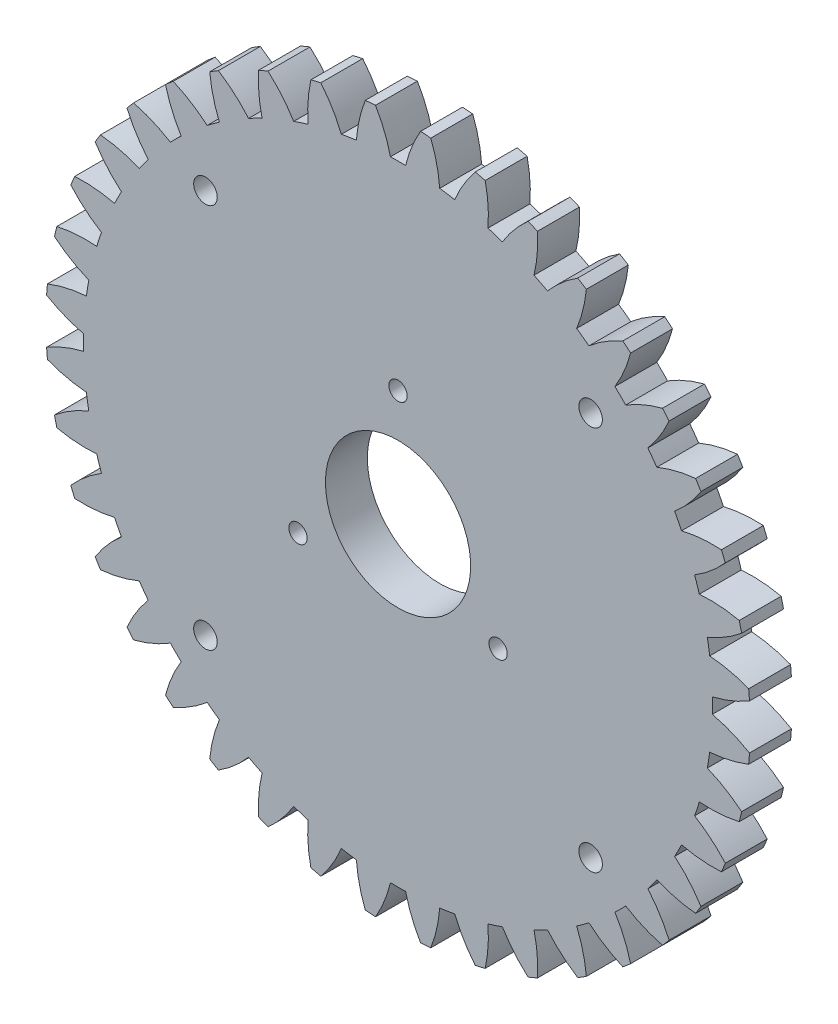
from build123d import *

# Parameters (mm, degrees)
SKETCH1_R           = 1.7859375
SKETCH1_R_2         = 19.05
BOSS_EXTRUDE1_DEPTH = 6.35
BOSS_EXTRUDE2_START = -6.35
SKETCH2_R           = 19.05
BOSS_EXTRUDE2_DEPTH = 6.35
SKETCH3_R           = 11
SKETCH3_R_2         = 1.3890625
CUT_EXTRUDE1_DEPTH  = 76.546869742


with BuildPart() as part:
    # Sketch1 → Boss-Extrude1 (new body)
    with BuildSketch(Plane.XY):
        with BuildLine():
            ThreePointArc((-53.230663286, 3.41351521), (-50.505194995, 2.070176319), (-47.609884913, 1.148267265))
            ThreePointArc((-47.609884913, 1.148267265), (-47.62373, 0), (-47.609884913, -1.148267265))
            ThreePointArc((-47.609884913, -1.148267265), (-50.505194995, -2.070176319), (-53.230663286, -3.41351521))
            ThreePointArc((-53.230663286, -3.41351521), (-53.175570581, -4.185008166), (-53.109296916, -4.955621162))
            ThreePointArc((-53.109296916, -4.955621162), (-50.207239162, -5.856064147), (-47.203356801, -6.313696687))
            ThreePointArc((-47.203356801, -6.313696687), (-47.037402857, -7.449992726), (-46.84409965, -8.581957067))
            ThreePointArc((-46.84409965, -8.581957067), (-49.559545311, -9.945442174), (-52.041314064, -11.698599508))
            ThreePointArc((-52.041314064, -11.698599508), (-51.866211554, -12.451975708), (-51.680203396, -13.202733694))
            ThreePointArc((-51.680203396, -13.202733694), (-48.673014471, -13.638108879), (-45.634525385, -13.620196473))
            ThreePointArc((-45.634525385, -13.620196473), (-45.292858747, -14.716541906), (-44.924857187, -15.804330603))
            ThreePointArc((-44.924857187, -15.804330603), (-47.393575143, -17.575818236), (-49.570534975, -19.695625461))
            ThreePointArc((-49.570534975, -19.695625461), (-49.279734264, -20.412334282), (-48.978571751, -21.124751105))
            ThreePointArc((-48.978571751, -21.124751105), (-45.940298628, -21.084338109), (-42.942020503, -20.591321819))
            ThreePointArc((-42.942020503, -20.591321819), (-42.433054136, -21.620720982), (-41.899415644, -22.637549069))
            ThreePointArc((-41.899415644, -22.637549069), (-44.060617865, -24.773419322), (-45.879164799, -27.207679749))
            ThreePointArc((-45.879164799, -27.207679749), (-45.479826367, -27.870073442), (-45.070925119, -28.526607034))
            ThreePointArc((-45.070925119, -28.526607034), (-42.076380166, -28.011400959), (-39.192140559, -27.055420484))
            ThreePointArc((-39.192140559, -27.055420484), (-38.528406906, -27.992526153), (-37.842271431, -28.913355947))
            ThreePointArc((-37.842271431, -28.913355947), (-39.642741945, -31.361016606), (-41.058097322, -34.049790665))
            ThreePointArc((-41.058097322, -34.049790665), (-40.560054205, -34.641558898), (-40.053482729, -35.226043224))
            ThreePointArc((-40.053482729, -35.226043224), (-37.17640158, -34.248730153), (-34.477220043, -32.853324904))
            ThreePointArc((-34.477220043, -32.853324904), (-33.675062428, -33.675062428), (-32.853324904, -34.477220043))
            ThreePointArc((-32.853324904, -34.477220043), (-34.248730153, -37.17640158), (-35.226043224, -40.053482729))
            ThreePointArc((-35.226043224, -40.053482729), (-34.641558898, -40.560054205), (-34.049790665, -41.058097322))
            ThreePointArc((-34.049790665, -41.058097322), (-31.361016606, -39.642741945), (-28.913355947, -37.842271431))
            ThreePointArc((-28.913355947, -37.842271431), (-27.992526153, -38.528406906), (-27.055420484, -39.192140559))
            ThreePointArc((-27.055420484, -39.192140559), (-28.011400959, -42.076380166), (-28.526607034, -45.070925119))
            ThreePointArc((-28.526607034, -45.070925119), (-27.870073442, -45.479826367), (-27.207679749, -45.879164799))
            ThreePointArc((-27.207679749, -45.879164799), (-24.773419322, -44.060617865), (-22.637549069, -41.899415644))
            ThreePointArc((-22.637549069, -41.899415644), (-21.620720982, -42.433054136), (-20.591321819, -42.942020503))
            ThreePointArc((-20.591321819, -42.942020503), (-21.084338109, -45.940298628), (-21.124751105, -48.978571751))
            ThreePointArc((-21.124751105, -48.978571751), (-20.412334282, -49.279734264), (-19.695625461, -49.570534975))
            ThreePointArc((-19.695625461, -49.570534975), (-17.575818236, -47.393575143), (-15.804330603, -44.924857187))
            ThreePointArc((-15.804330603, -44.924857187), (-14.716541906, -45.292858747), (-13.620196473, -45.634525385))
            ThreePointArc((-13.620196473, -45.634525385), (-13.638108879, -48.673014471), (-13.202733694, -51.680203396))
            ThreePointArc((-13.202733694, -51.680203396), (-12.451975708, -51.866211554), (-11.698599508, -52.041314064))
            ThreePointArc((-11.698599508, -52.041314064), (-9.945442174, -49.559545311), (-8.581957067, -46.84409965))
            ThreePointArc((-8.581957067, -46.84409965), (-7.449992726, -47.037402857), (-6.313696687, -47.203356801))
            ThreePointArc((-6.313696687, -47.203356801), (-5.856064147, -50.207239162), (-4.955621162, -53.109296916))
            ThreePointArc((-4.955621162, -53.109296916), (-4.185008166, -53.175570581), (-3.41351521, -53.230663286))
            ThreePointArc((-3.41351521, -53.230663286), (-2.070176319, -50.505194995), (-1.148267265, -47.609884913))
            ThreePointArc((-1.148267265, -47.609884913), (0, -47.62373), (1.148267265, -47.609884913))
            ThreePointArc((1.148267265, -47.609884913), (2.070176319, -50.505194995), (3.41351521, -53.230663286))
            ThreePointArc((3.41351521, -53.230663286), (4.185008166, -53.175570581), (4.955621162, -53.109296916))
            ThreePointArc((4.955621162, -53.109296916), (5.856064147, -50.207239162), (6.313696687, -47.203356801))
            ThreePointArc((6.313696687, -47.203356801), (7.449992726, -47.037402857), (8.581957067, -46.84409965))
            ThreePointArc((8.581957067, -46.84409965), (9.945442174, -49.559545311), (11.698599508, -52.041314064))
            ThreePointArc((11.698599508, -52.041314064), (12.451975708, -51.866211554), (13.202733694, -51.680203396))
            ThreePointArc((13.202733694, -51.680203396), (13.638108879, -48.673014471), (13.620196473, -45.634525385))
            ThreePointArc((13.620196473, -45.634525385), (14.716541906, -45.292858747), (15.804330603, -44.924857187))
            ThreePointArc((15.804330603, -44.924857187), (17.575818236, -47.393575143), (19.695625461, -49.570534975))
            ThreePointArc((19.695625461, -49.570534975), (20.412334282, -49.279734264), (21.124751105, -48.978571751))
            ThreePointArc((21.124751105, -48.978571751), (21.084338109, -45.940298628), (20.591321819, -42.942020503))
            ThreePointArc((20.591321819, -42.942020503), (21.620720982, -42.433054136), (22.637549069, -41.899415644))
            ThreePointArc((22.637549069, -41.899415644), (24.773419322, -44.060617865), (27.207679749, -45.879164799))
            ThreePointArc((27.207679749, -45.879164799), (27.870073442, -45.479826367), (28.526607034, -45.070925119))
            ThreePointArc((28.526607034, -45.070925119), (28.011400959, -42.076380166), (27.055420484, -39.192140559))
            ThreePointArc((27.055420484, -39.192140559), (27.992526153, -38.528406906), (28.913355947, -37.842271431))
            ThreePointArc((28.913355947, -37.842271431), (31.361016606, -39.642741945), (34.049790665, -41.058097322))
            ThreePointArc((34.049790665, -41.058097322), (34.641558898, -40.560054205), (35.226043224, -40.053482729))
            ThreePointArc((35.226043224, -40.053482729), (34.248730153, -37.17640158), (32.853324904, -34.477220043))
            ThreePointArc((32.853324904, -34.477220043), (33.675062428, -33.675062428), (34.477220043, -32.853324904))
            ThreePointArc((34.477220043, -32.853324904), (37.17640158, -34.248730153), (40.053482729, -35.226043224))
            ThreePointArc((40.053482729, -35.226043224), (40.560054205, -34.641558898), (41.058097322, -34.049790665))
            ThreePointArc((41.058097322, -34.049790665), (39.642741945, -31.361016606), (37.842271431, -28.913355947))
            ThreePointArc((37.842271431, -28.913355947), (38.528406906, -27.992526153), (39.192140559, -27.055420484))
            ThreePointArc((39.192140559, -27.055420484), (42.076380166, -28.011400959), (45.070925119, -28.526607034))
            ThreePointArc((45.070925119, -28.526607034), (45.479826367, -27.870073442), (45.879164799, -27.207679749))
            ThreePointArc((45.879164799, -27.207679749), (44.060617865, -24.773419322), (41.899415644, -22.637549069))
            ThreePointArc((41.899415644, -22.637549069), (42.433054136, -21.620720982), (42.942020503, -20.591321819))
            ThreePointArc((42.942020503, -20.591321819), (45.940298628, -21.084338109), (48.978571751, -21.124751105))
            ThreePointArc((48.978571751, -21.124751105), (49.279734264, -20.412334282), (49.570534975, -19.695625461))
            ThreePointArc((49.570534975, -19.695625461), (47.393575143, -17.575818236), (44.924857187, -15.804330603))
            ThreePointArc((44.924857187, -15.804330603), (45.292858747, -14.716541906), (45.634525385, -13.620196473))
            ThreePointArc((45.634525385, -13.620196473), (48.673014471, -13.638108879), (51.680203396, -13.202733694))
            ThreePointArc((51.680203396, -13.202733694), (51.866211554, -12.451975708), (52.041314064, -11.698599508))
            ThreePointArc((52.041314064, -11.698599508), (49.559545311, -9.945442174), (46.84409965, -8.581957067))
            ThreePointArc((46.84409965, -8.581957067), (47.037402857, -7.449992726), (47.203356801, -6.313696687))
            ThreePointArc((47.203356801, -6.313696687), (50.207239162, -5.856064147), (53.109296916, -4.955621162))
            ThreePointArc((53.109296916, -4.955621162), (53.175570581, -4.185008166), (53.230663286, -3.41351521))
            ThreePointArc((53.230663286, -3.41351521), (50.505194995, -2.070176319), (47.609884913, -1.148267265))
            ThreePointArc((47.609884913, -1.148267265), (47.62373, 0), (47.609884913, 1.148267265))
            ThreePointArc((47.609884913, 1.148267265), (50.505194995, 2.070176319), (53.230663286, 3.41351521))
            ThreePointArc((53.230663286, 3.41351521), (53.175570581, 4.185008166), (53.109296916, 4.955621162))
            ThreePointArc((53.109296916, 4.955621162), (50.207239162, 5.856064147), (47.203356801, 6.313696687))
            ThreePointArc((47.203356801, 6.313696687), (47.037402857, 7.449992726), (46.84409965, 8.581957067))
            ThreePointArc((46.84409965, 8.581957067), (49.559545311, 9.945442174), (52.041314064, 11.698599508))
            ThreePointArc((52.041314064, 11.698599508), (51.866211554, 12.451975708), (51.680203396, 13.202733694))
            ThreePointArc((51.680203396, 13.202733694), (48.673014471, 13.638108879), (45.634525385, 13.620196473))
            ThreePointArc((45.634525385, 13.620196473), (45.292858747, 14.716541906), (44.924857187, 15.804330603))
            ThreePointArc((44.924857187, 15.804330603), (47.393575143, 17.575818236), (49.570534975, 19.695625461))
            ThreePointArc((49.570534975, 19.695625461), (49.279734264, 20.412334282), (48.978571751, 21.124751105))
            ThreePointArc((48.978571751, 21.124751105), (45.940298628, 21.084338109), (42.942020503, 20.591321819))
            ThreePointArc((42.942020503, 20.591321819), (42.433054136, 21.620720982), (41.899415644, 22.637549069))
            ThreePointArc((41.899415644, 22.637549069), (44.060617865, 24.773419322), (45.879164799, 27.207679749))
            ThreePointArc((45.879164799, 27.207679749), (45.479826367, 27.870073442), (45.070925119, 28.526607034))
            ThreePointArc((45.070925119, 28.526607034), (42.076380166, 28.011400959), (39.192140559, 27.055420484))
            ThreePointArc((39.192140559, 27.055420484), (38.528406906, 27.992526153), (37.842271431, 28.913355947))
            ThreePointArc((37.842271431, 28.913355947), (39.642741945, 31.361016606), (41.058097322, 34.049790665))
            ThreePointArc((41.058097322, 34.049790665), (40.560054205, 34.641558898), (40.053482729, 35.226043224))
            ThreePointArc((40.053482729, 35.226043224), (37.17640158, 34.248730153), (34.477220043, 32.853324904))
            ThreePointArc((34.477220043, 32.853324904), (33.675062428, 33.675062428), (32.853324904, 34.477220043))
            ThreePointArc((32.853324904, 34.477220043), (34.248730153, 37.17640158), (35.226043224, 40.053482729))
            ThreePointArc((35.226043224, 40.053482729), (34.641558898, 40.560054205), (34.049790665, 41.058097322))
            ThreePointArc((34.049790665, 41.058097322), (31.361016606, 39.642741945), (28.913355947, 37.842271431))
            ThreePointArc((28.913355947, 37.842271431), (27.992526153, 38.528406906), (27.055420484, 39.192140559))
            ThreePointArc((27.055420484, 39.192140559), (28.011400959, 42.076380166), (28.526607034, 45.070925119))
            ThreePointArc((28.526607034, 45.070925119), (27.870073442, 45.479826367), (27.207679749, 45.879164799))
            ThreePointArc((27.207679749, 45.879164799), (24.773419322, 44.060617865), (22.637549069, 41.899415644))
            ThreePointArc((22.637549069, 41.899415644), (21.620720982, 42.433054136), (20.591321819, 42.942020503))
            ThreePointArc((20.591321819, 42.942020503), (21.084338109, 45.940298628), (21.124751105, 48.978571751))
            ThreePointArc((21.124751105, 48.978571751), (20.412334282, 49.279734264), (19.695625461, 49.570534975))
            ThreePointArc((19.695625461, 49.570534975), (17.575818236, 47.393575143), (15.804330603, 44.924857187))
            ThreePointArc((15.804330603, 44.924857187), (14.716541906, 45.292858747), (13.620196473, 45.634525385))
            ThreePointArc((13.620196473, 45.634525385), (13.638108879, 48.673014471), (13.202733694, 51.680203396))
            ThreePointArc((13.202733694, 51.680203396), (12.451975708, 51.866211554), (11.698599508, 52.041314064))
            ThreePointArc((11.698599508, 52.041314064), (9.945442174, 49.559545311), (8.581957067, 46.84409965))
            ThreePointArc((8.581957067, 46.84409965), (7.449992726, 47.037402857), (6.313696687, 47.203356801))
            ThreePointArc((6.313696687, 47.203356801), (5.856064147, 50.207239162), (4.955621162, 53.109296916))
            ThreePointArc((4.955621162, 53.109296916), (4.185008166, 53.175570581), (3.41351521, 53.230663286))
            ThreePointArc((3.41351521, 53.230663286), (2.070176319, 50.505194995), (1.148267265, 47.609884913))
            ThreePointArc((1.148267265, 47.609884913), (0, 47.62373), (-1.148267265, 47.609884913))
            ThreePointArc((-1.148267265, 47.609884913), (-2.070176319, 50.505194995), (-3.41351521, 53.230663286))
            ThreePointArc((-3.41351521, 53.230663286), (-4.185008166, 53.175570581), (-4.955621162, 53.109296916))
            ThreePointArc((-4.955621162, 53.109296916), (-5.856064147, 50.207239162), (-6.313696687, 47.203356801))
            ThreePointArc((-6.313696687, 47.203356801), (-7.449992726, 47.037402857), (-8.581957067, 46.84409965))
            ThreePointArc((-8.581957067, 46.84409965), (-9.945442174, 49.559545311), (-11.698599508, 52.041314064))
            ThreePointArc((-11.698599508, 52.041314064), (-12.451975708, 51.866211554), (-13.202733694, 51.680203396))
            ThreePointArc((-13.202733694, 51.680203396), (-13.638108879, 48.673014471), (-13.620196473, 45.634525385))
            ThreePointArc((-13.620196473, 45.634525385), (-14.716541906, 45.292858747), (-15.804330603, 44.924857187))
            ThreePointArc((-15.804330603, 44.924857187), (-17.575818236, 47.393575143), (-19.695625461, 49.570534975))
            ThreePointArc((-19.695625461, 49.570534975), (-20.412334282, 49.279734264), (-21.124751105, 48.978571751))
            ThreePointArc((-21.124751105, 48.978571751), (-21.084338109, 45.940298628), (-20.591321819, 42.942020503))
            ThreePointArc((-20.591321819, 42.942020503), (-21.620720982, 42.433054136), (-22.637549069, 41.899415644))
            ThreePointArc((-22.637549069, 41.899415644), (-24.773419322, 44.060617865), (-27.207679749, 45.879164799))
            ThreePointArc((-27.207679749, 45.879164799), (-27.870073442, 45.479826367), (-28.526607034, 45.070925119))
            ThreePointArc((-28.526607034, 45.070925119), (-28.011400959, 42.076380166), (-27.055420484, 39.192140559))
            ThreePointArc((-27.055420484, 39.192140559), (-27.992526153, 38.528406906), (-28.913355947, 37.842271431))
            ThreePointArc((-28.913355947, 37.842271431), (-31.361016606, 39.642741945), (-34.049790665, 41.058097322))
            ThreePointArc((-34.049790665, 41.058097322), (-34.641558898, 40.560054205), (-35.226043224, 40.053482729))
            ThreePointArc((-35.226043224, 40.053482729), (-34.248730153, 37.17640158), (-32.853324904, 34.477220043))
            ThreePointArc((-32.853324904, 34.477220043), (-33.675062428, 33.675062428), (-34.477220043, 32.853324904))
            ThreePointArc((-34.477220043, 32.853324904), (-37.17640158, 34.248730153), (-40.053482729, 35.226043224))
            ThreePointArc((-40.053482729, 35.226043224), (-40.560054205, 34.641558898), (-41.058097322, 34.049790665))
            ThreePointArc((-41.058097322, 34.049790665), (-39.642741945, 31.361016606), (-37.842271431, 28.913355947))
            ThreePointArc((-37.842271431, 28.913355947), (-38.528406906, 27.992526153), (-39.192140559, 27.055420484))
            ThreePointArc((-39.192140559, 27.055420484), (-42.076380166, 28.011400959), (-45.070925119, 28.526607034))
            ThreePointArc((-45.070925119, 28.526607034), (-45.479826367, 27.870073442), (-45.879164799, 27.207679749))
            ThreePointArc((-45.879164799, 27.207679749), (-44.060617865, 24.773419322), (-41.899415644, 22.637549069))
            ThreePointArc((-41.899415644, 22.637549069), (-42.433054136, 21.620720982), (-42.942020503, 20.591321819))
            ThreePointArc((-42.942020503, 20.591321819), (-45.940298628, 21.084338109), (-48.978571751, 21.124751105))
            ThreePointArc((-48.978571751, 21.124751105), (-49.279734264, 20.412334282), (-49.570534975, 19.695625461))
            ThreePointArc((-49.570534975, 19.695625461), (-47.393575143, 17.575818236), (-44.924857187, 15.804330603))
            ThreePointArc((-44.924857187, 15.804330603), (-45.292858747, 14.716541906), (-45.634525385, 13.620196473))
            ThreePointArc((-45.634525385, 13.620196473), (-48.673014471, 13.638108879), (-51.680203396, 13.202733694))
            ThreePointArc((-51.680203396, 13.202733694), (-51.866211554, 12.451975708), (-52.041314064, 11.698599508))
            ThreePointArc((-52.041314064, 11.698599508), (-49.559545311, 9.945442174), (-46.84409965, 8.581957067))
            ThreePointArc((-46.84409965, 8.581957067), (-47.037402857, 7.449992726), (-47.203356801, 6.313696687))
            ThreePointArc((-47.203356801, 6.313696687), (-50.207239162, 5.856064147), (-53.109296916, 4.955621162))
            ThreePointArc((-53.109296916, 4.955621162), (-53.175570581, 4.185008166), (-53.230663286, 3.41351521))
        make_face()
        with Locations((29.168154724, 29.168154724)):
            Circle(SKETCH1_R, mode=Mode.SUBTRACT)
        with Locations((29.168154724, -29.168154724)):
            Circle(SKETCH1_R, mode=Mode.SUBTRACT)
        with Locations((-29.168154724, -29.168154724)):
            Circle(SKETCH1_R, mode=Mode.SUBTRACT)
        with Locations((-29.168154724, 29.168154724)):
            Circle(SKETCH1_R, mode=Mode.SUBTRACT)
        Circle(SKETCH1_R_2, mode=Mode.SUBTRACT)
    extrude(amount=BOSS_EXTRUDE1_DEPTH)

    # Sketch2 → Boss-Extrude2 (add)
    with BuildSketch(Plane.XY.offset(6.35).offset(BOSS_EXTRUDE2_START)):
        Circle(SKETCH2_R)
    extrude(amount=BOSS_EXTRUDE2_DEPTH)

    # Sketch3 → Cut-Extrude1 (cut, through all)
    with BuildSketch(Plane(origin=(0, 0, 0), x_dir=(-1, 0, 0), z_dir=(0, 0, -1))):
        Circle(SKETCH3_R)
        with Locations((0, 17.5)):
            Circle(SKETCH3_R_2)
        with Locations((15.155444566, -8.75)):
            Circle(SKETCH3_R_2)
        with Locations((-15.155444566, -8.75)):
            Circle(SKETCH3_R_2)
    extrude(amount=-CUT_EXTRUDE1_DEPTH, mode=Mode.SUBTRACT)


solid = part.part
